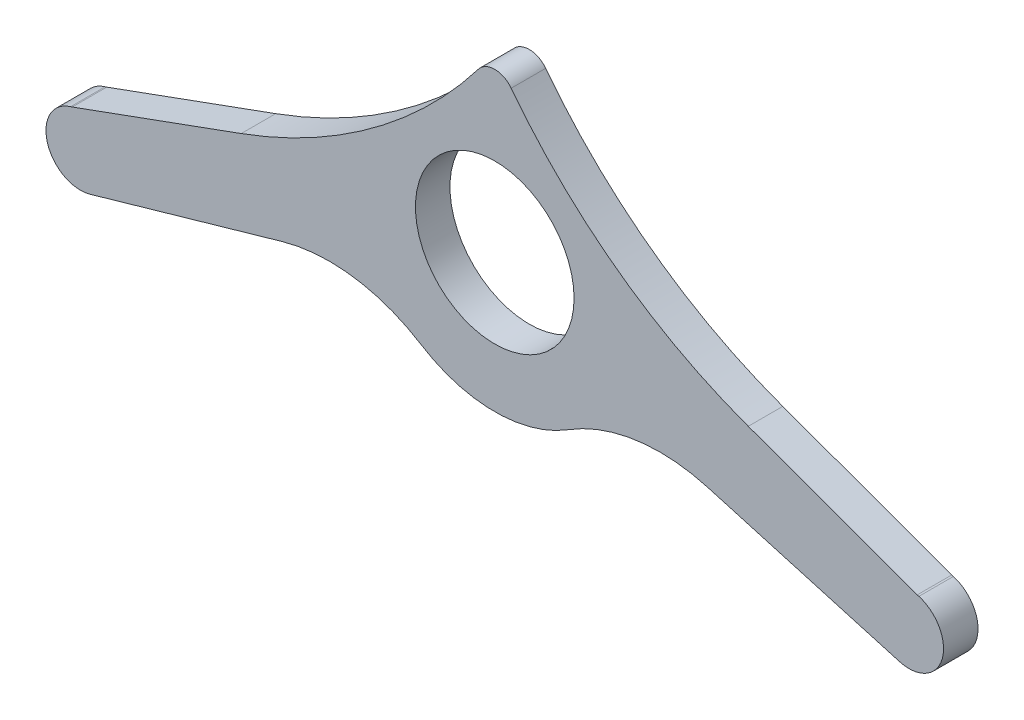
from build123d import *

# Parameters (mm, degrees)
SKETCH1_R           = 11.5
BOSS_EXTRUDE2_DEPTH = 5


with BuildPart() as part:
    # Sketch1 → Boss-Extrude2 (new body)
    with BuildSketch(Plane.XY):
        with BuildLine():
            ThreePointArc((2.384173399, 21.820911092), (0, 23), (-2.384173399, 21.820911092))
            ThreePointArc((-2.384173399, 21.820911092), (-17.761952084, 6.72401264), (-36.761417585, -3.445192388))
            Line((-36.761417585, -3.445192388), (-61.264901468, -12.363731157))
            Line((-61.264901468, -12.363731157), (-61.502328705, -12.434243309))
            ThreePointArc((-61.502328705, -12.434243309), (-64.87860936, -18.628180071), (-58.700669217, -22.033643218))
            Line((-58.700669217, -22.033643218), (-30.863510665, -14.051466451))
            ThreePointArc((-30.863510665, -14.051466451), (-20.452273896, -13.332100428), (-10.654478564, -16.925781711))
            ThreePointArc((-10.654478564, -16.925781711), (0, -20), (10.654478564, -16.925781711))
            ThreePointArc((10.654478564, -16.925781711), (20.452273896, -13.332100428), (30.863510665, -14.051466451))
            Line((30.863510665, -14.051466451), (58.700669217, -22.033643218))
            ThreePointArc((58.700669217, -22.033643218), (64.87860936, -18.628180071), (61.502328705, -12.434243309))
            Line((61.502328705, -12.434243309), (61.264901468, -12.363731157))
            Line((61.264901468, -12.363731157), (36.761417585, -3.445192388))
            ThreePointArc((36.761417585, -3.445192388), (17.761952084, 6.72401264), (2.384173399, 21.820911092))
        make_face()
        Circle(SKETCH1_R, mode=Mode.SUBTRACT)
    extrude(amount=BOSS_EXTRUDE2_DEPTH)


solid = part.part
